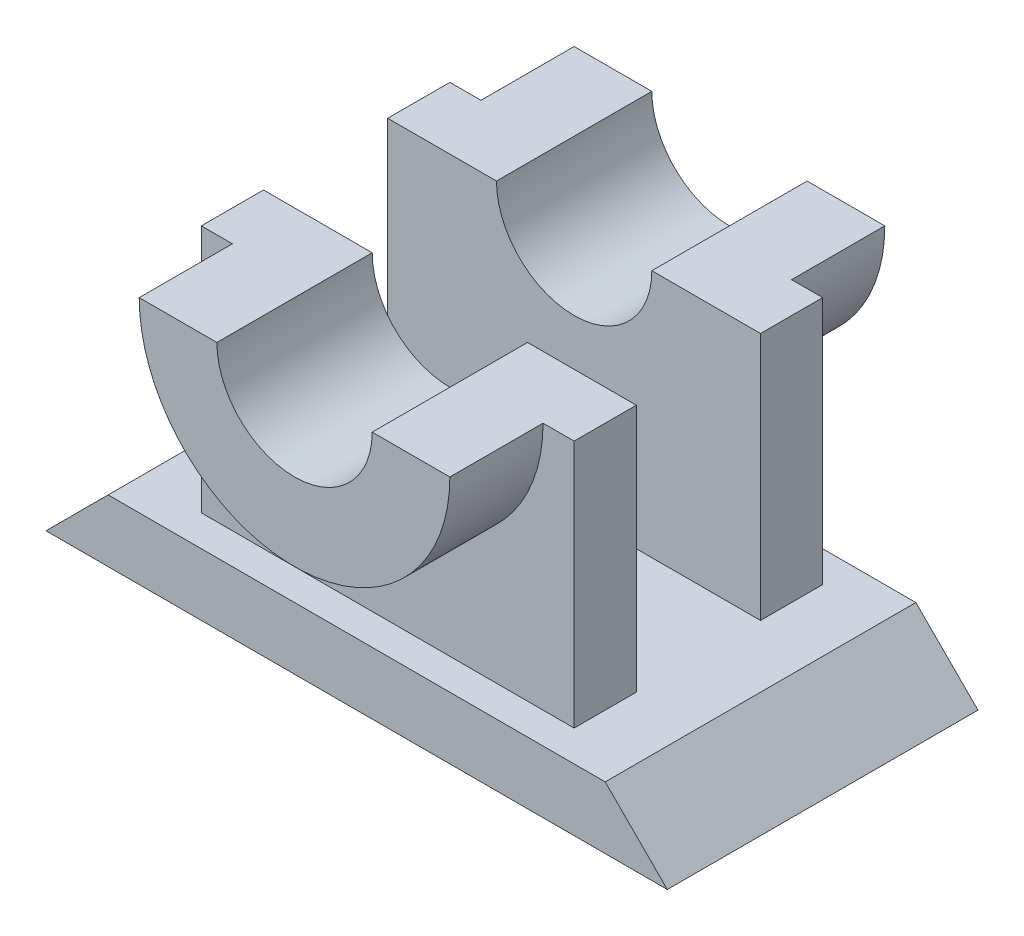
from build123d import *

# Parameters (mm, degrees)
BOSS_EXTRUDE1_DEPTH = 25
BOSS_EXTRUDE2_START = 10
BOSS_EXTRUDE2_DEPTH = 10
BOSS_EXTRUDE3_START = -20
BOSS_EXTRUDE3_DEPTH = 10
BOSS_EXTRUDE4_START = -35
BOSS_EXTRUDE4_DEPTH = 25
BOSS_EXTRUDE5_START = 10
BOSS_EXTRUDE5_DEPTH = 25


with BuildPart() as part:
    # Sketch1 → Boss-Extrude1 (new, symmetric)
    with BuildSketch(Plane.XY):
        Polygon((50, 10), (50, 0), (100, 0), (90, 10), (80, 10), align=None)
        Polygon((10, 10), (0, 0), (50, 0), (50, 10), (20, 10), align=None)
    extrude(amount=BOSS_EXTRUDE1_DEPTH, both=True)

    # Sketch1<3> → Boss-Extrude2 (add)
    with BuildSketch(Plane.XY.offset(BOSS_EXTRUDE2_START)):
        with BuildLine():
            Line((50, 25), (50, 10))
            Line((50, 10), (80, 10))
            Line((80, 10), (80, 50))
            Line((80, 50), (75, 50))
            ThreePointArc((75, 50), (67.67766953, 32.32233047), (50, 25))
        make_face()
        with BuildLine():
            Line((20, 10), (50, 10))
            Line((50, 10), (50, 25))
            ThreePointArc((50, 25), (32.32233047, 32.32233047), (25, 50))
            Line((25, 50), (20, 50))
            Line((20, 50), (20, 10))
        make_face()
    extrude(amount=BOSS_EXTRUDE2_DEPTH)

    # Sketch1<4> → Boss-Extrude3 (add)
    with BuildSketch(Plane.XY.offset(BOSS_EXTRUDE3_START)):
        with BuildLine():
            Line((50, 25), (50, 10))
            Line((50, 10), (80, 10))
            Line((80, 10), (80, 50))
            Line((80, 50), (75, 50))
            ThreePointArc((75, 50), (67.67766953, 32.32233047), (50, 25))
        make_face()
        with BuildLine():
            Line((20, 10), (50, 10))
            Line((50, 10), (50, 25))
            ThreePointArc((50, 25), (32.32233047, 32.32233047), (25, 50))
            Line((25, 50), (20, 50))
            Line((20, 50), (20, 10))
        make_face()
    extrude(amount=BOSS_EXTRUDE3_DEPTH)

    # Sketch1<5> → Boss-Extrude4 (add)
    with BuildSketch(Plane.XY.offset(BOSS_EXTRUDE4_START)):
        with BuildLine():
            Line((37.5, 50), (25, 50))
            ThreePointArc((25, 50), (50, 25), (75, 50))
            Line((75, 50), (62.5, 50))
            ThreePointArc((62.5, 50), (50, 37.5), (37.5, 50))
        make_face()
    extrude(amount=BOSS_EXTRUDE4_DEPTH)

    # Sketch1<6> → Boss-Extrude5 (add)
    with BuildSketch(Plane.XY.offset(BOSS_EXTRUDE5_START)):
        with BuildLine():
            Line((37.5, 50), (25, 50))
            ThreePointArc((25, 50), (50, 25), (75, 50))
            Line((75, 50), (62.5, 50))
            ThreePointArc((62.5, 50), (50, 37.5), (37.5, 50))
        make_face()
    extrude(amount=BOSS_EXTRUDE5_DEPTH)


solid = part.part
